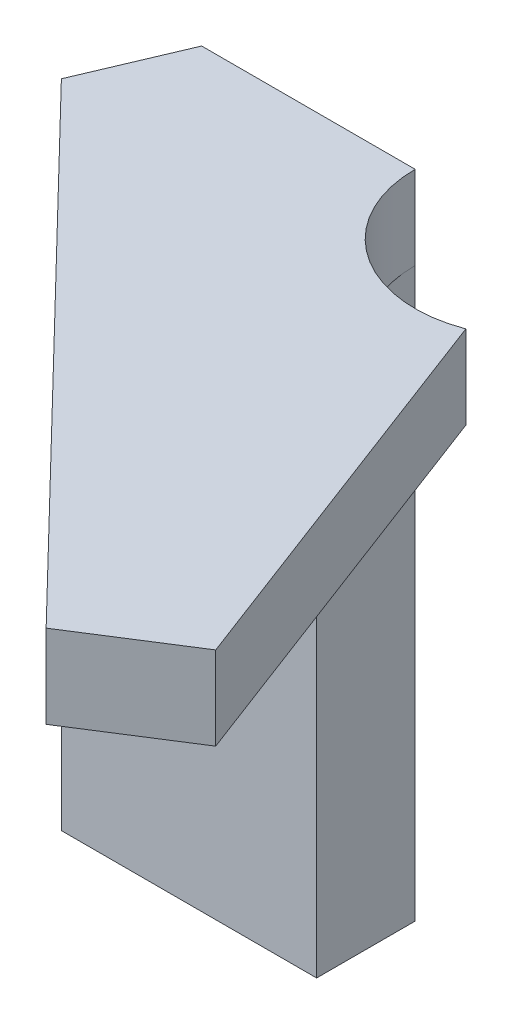
from build123d import *

# Parameters (mm, degrees)
BOSS_EXTRUDE1_DEPTH = 11.43
BOSS_EXTRUDE2_DEPTH = 77.866799282


with BuildPart() as part:
    # Sketch1 → Boss-Extrude1 (new body)
    with BuildSketch(Plane(origin=(0, 68.54, 0), x_dir=(1, 0, 0), z_dir=(0, 1, 0))):
        with BuildLine():
            Line((-505.199519379, -28.941561379), (-510.924193781, -42.454904444))
            Line((-510.924193781, -42.454904444), (-446.727083924, -108.742597242))
            Line((-446.727083924, -108.742597242), (-432.506297568, -99.706904201))
            Line((-432.506297568, -99.706904201), (-453.485090126, -44.423263798))
            ThreePointArc((-453.485090126, -44.423263798), (-468.76509838, -42.570216845), (-475.918740123, -28.941649602))
            Line((-475.918740123, -28.941649602), (-505.199519379, -28.941561379))
        make_face()
    extrude(amount=-BOSS_EXTRUDE1_DEPTH)

    # Sketch4 → Boss-Extrude2 (add)
    with BuildSketch(Plane(origin=(0, -20.756799282, 0), x_dir=(1, 0, 0), z_dir=(0, 1, 0))):
        Polygon((-505.199519379, -28.941561379), (-510.924193781, -42.454904444), (-475.918740123, -42.454904444), (-475.918740123, -28.941649602), align=None)
    extrude(amount=BOSS_EXTRUDE2_DEPTH)


solid = part.part
